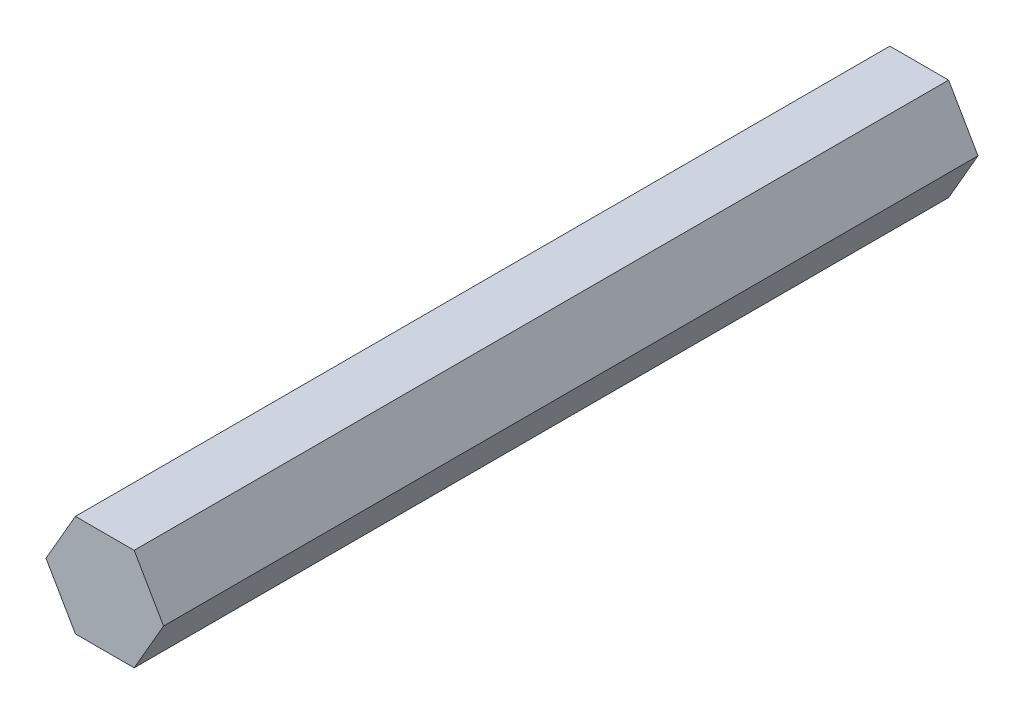
from build123d import *

# Parameters (mm, degrees)
BOSS_EXTRUDE1_DEPTH = 50.8


with BuildPart() as part:
    # Sketch1 → Boss-Extrude1 (new, symmetric)
    with BuildSketch(Plane.XY):
        Polygon((3.666174209, -6.35), (7.332348419, 0), (3.666174209, 6.35), (-3.666174209, 6.35), (-7.332348419, 0), (-3.666174209, -6.35), align=None)
    extrude(amount=BOSS_EXTRUDE1_DEPTH, both=True)


solid = part.part
